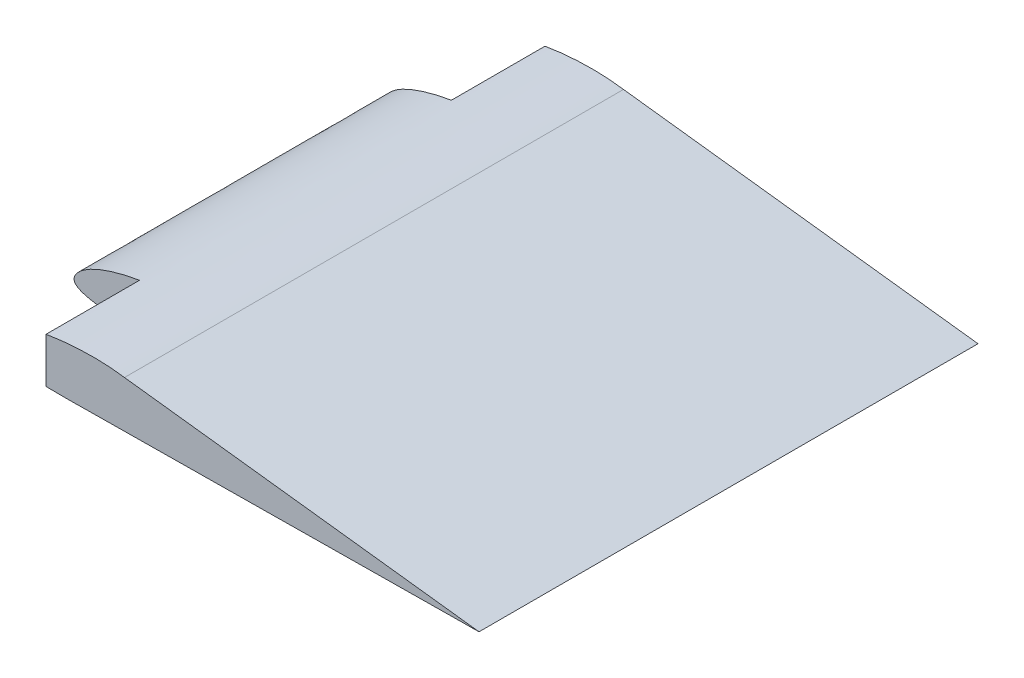
from build123d import *

# Parameters (mm, degrees)
AIRFOIL_DEPTH                  = 203.2
SKETCH2_W                      = 26.67
SKETCH2_H                      = 38.1
CUT_EXTRUDE1_DEPTH             = 0.254
CUT_EXTRUDE1_DIRECTION_2_REACH = 290.289


with BuildPart() as part:
    # ArbitraryAirfoil → Airfoil (new body)
    with BuildSketch(Plane.XY):
        with BuildLine():
            Line((203.020944151, 6.161571825), (45.244085748, 4.547707836))
            add(Edge.make_bspline(
                [(45.244085748, 4.547707836), (17.859199604, 4.013414162), (-2.246647298, 5.75795696), (3.906945379, 20.443479424), (37.805109933, 26.780316623), (58.641335966, 23.658932819)],
                knots=[0, 0, 0, 0, 0.290580958, 0.390580958, 1, 1, 1, 1], degree=3))
            Line((58.641335966, 23.658932819), (203.020944151, 6.161571825))
        make_face()
    extrude(amount=AIRFOIL_DEPTH)

    # Sketch2 → Cut-Extrude1 (cut)
    with BuildSketch(Plane(origin=(0, 0, 0), x_dir=(1, 0, 0), z_dir=(0, 1, 0))):
        with Locations((13.335, -19.05)):
            Rectangle(SKETCH2_W, SKETCH2_H)
        with Locations((13.335, -184.15)):
            Rectangle(SKETCH2_W, SKETCH2_H)
    extrude(amount=-CUT_EXTRUDE1_DEPTH, mode=Mode.SUBTRACT)

    # Sketch2 → Cut-Extrude1 direction 2 (cut, up to next)
    with BuildSketch(Plane(origin=(0, 0, 0), x_dir=(1, 0, 0), z_dir=(0, 1, 0)), mode=Mode.PRIVATE) as cut_extrude1_direction_2_sk1:
        with Locations((13.335, -19.05)):
            Rectangle(SKETCH2_W, SKETCH2_H)
    cut_extrude1_direction_2_tool1 = extrude(cut_extrude1_direction_2_sk1.sketch, amount=CUT_EXTRUDE1_DIRECTION_2_REACH, mode=Mode.PRIVATE) & part.part
    # Sketch2 → Cut-Extrude1 direction 2 (cut, up to next)
    with BuildSketch(Plane(origin=(0, 0, 0), x_dir=(1, 0, 0), z_dir=(0, 1, 0)), mode=Mode.PRIVATE) as cut_extrude1_direction_2_sk2:
        with Locations((13.335, -184.15)):
            Rectangle(SKETCH2_W, SKETCH2_H)
    cut_extrude1_direction_2_tool2 = extrude(cut_extrude1_direction_2_sk2.sketch, amount=CUT_EXTRUDE1_DIRECTION_2_REACH, mode=Mode.PRIVATE) & part.part
    add(cut_extrude1_direction_2_tool1.solids().sort_by_distance((13.335, 0, 19.05))[0], mode=Mode.SUBTRACT)
    add(cut_extrude1_direction_2_tool2.solids().sort_by_distance((13.335, 0, 184.15))[0], mode=Mode.SUBTRACT)


solid = part.part
